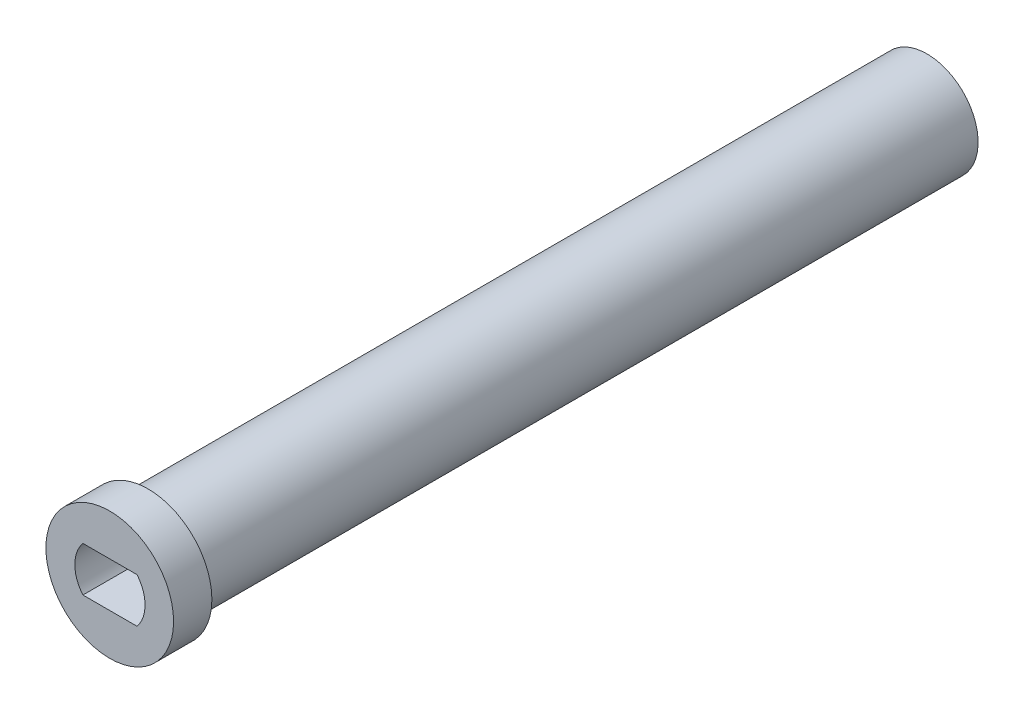
from build123d import *
from build123d.topology import SkipClean

# Parameters (mm, degrees)
SKETCH1_R               = 4
BOSS_EXTRUDE1_DEPTH     = 40
SKETCH2_R               = 5
BOSS_EXTRUDE2_DEPTH     = 3
CUT_EXTRUDE1_DEPTH      = 43
CUT_EXTRUDE1_DEPTH_BACK = 3
SKETCH1_3_R             = 4
BOSS_EXTRUDE3_DEPTH     = 23
BOSS_EXTRUDE4_START     = 24
SKETCH3_R               = 4
BOSS_EXTRUDE4_DEPTH     = 24


with BuildPart() as part:
    # Sketch1 → Boss-Extrude1 (new body)
    with BuildSketch(Plane.XY):
        Circle(SKETCH1_R)
        with BuildLine():
            Line((-2.100590034, 1.75), (2.142050653, 1.75))
            ThreePointArc((2.142050653, 1.75), (2.766022596, 0), (2.142050653, -1.75))
            Line((2.142050653, -1.75), (-2.100590034, -1.75))
            ThreePointArc((-2.100590034, -1.75), (-2.733195007, 0), (-2.100590034, 1.75))
        make_face(mode=Mode.SUBTRACT)
    extrude(amount=BOSS_EXTRUDE1_DEPTH)

    # Sketch2 → Boss-Extrude2 (add)
    with BuildSketch(Plane.XY.offset(40)):
        Circle(SKETCH2_R)
    extrude(amount=-BOSS_EXTRUDE2_DEPTH)

    # Sketch1<2> → Cut-Extrude1 (cut, two sides: drawn at the far end of the back side and taken through both)
    with SkipClean():  # the faces are left unmerged after this step: merging them gives an invalid solid
        with BuildSketch(Plane.XY.offset(-CUT_EXTRUDE1_DEPTH_BACK)):
            with BuildLine():
                Line((2.142050653, 1.75), (-2.100590034, 1.75))
                ThreePointArc((-2.100590034, 1.75), (-2.733195007, 0), (-2.100590034, -1.75))
                Line((-2.100590034, -1.75), (2.142050653, -1.75))
                ThreePointArc((2.142050653, -1.75), (2.766022596, 0), (2.142050653, 1.75))
            make_face()
        extrude(amount=CUT_EXTRUDE1_DEPTH + CUT_EXTRUDE1_DEPTH_BACK, mode=Mode.SUBTRACT)
    add(part.part.scale(1), mode=Mode.REPLACE)  # the faces are merged on a copy

    # Sketch1<3> → Boss-Extrude3 (add)
    with BuildSketch(Plane.XY):
        Circle(SKETCH1_3_R)
    extrude(amount=BOSS_EXTRUDE3_DEPTH)

    # Sketch3 → Boss-Extrude4 (add)
    with BuildSketch(Plane(origin=(0, 0, 0), x_dir=(-1, 0, 0), z_dir=(0, 0, -1)).offset(BOSS_EXTRUDE4_START)):
        Circle(SKETCH3_R)
    extrude(amount=-BOSS_EXTRUDE4_DEPTH)


solid = part.part
